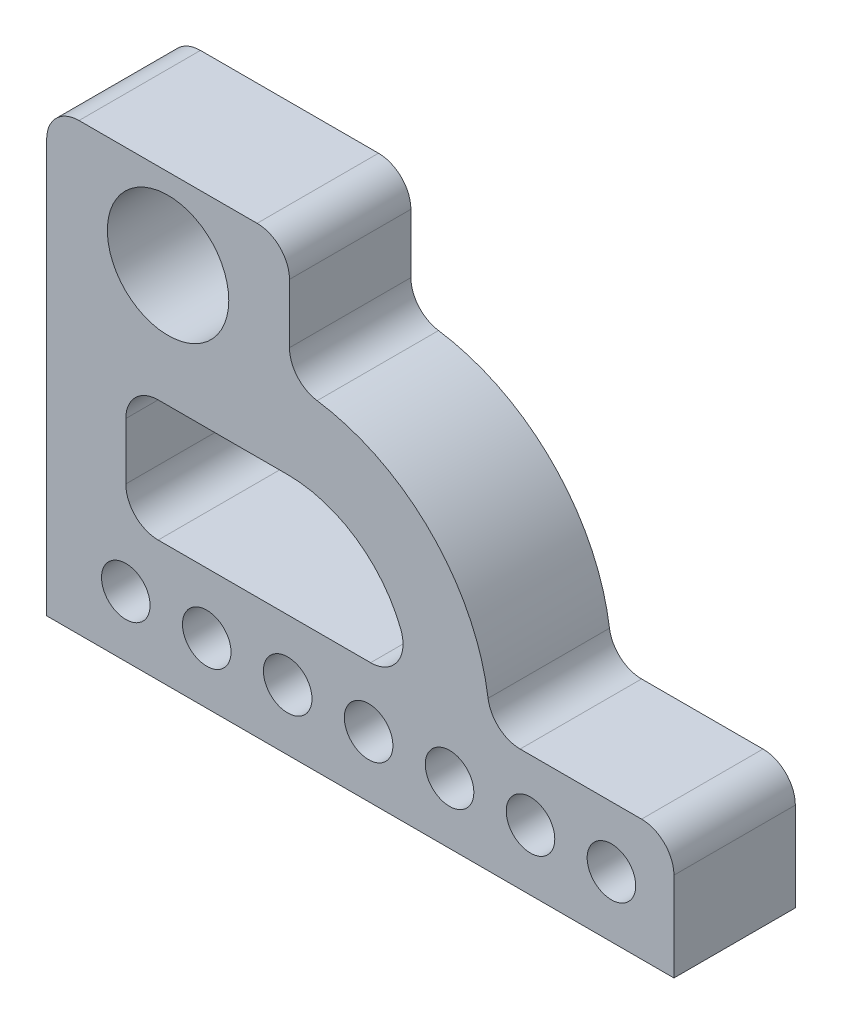
from build123d import *

# Parameters (mm, degrees)
SKETCH1_R           = 15
SKETCH1_R_2         = 6
BOSS_EXTRUDE1_DEPTH = 30


with BuildPart() as part:
    # Sketch1 → Boss-Extrude1 (new body)
    with BuildSketch(Plane.XY):
        with BuildLine():
            Line((-59.555920585, -15.55654054), (95.444079415, -15.55654054))
            Line((95.444079415, -15.55654054), (95.444079415, 6.44345946))
            ThreePointArc((95.444079415, 6.44345946), (93.100933664, 12.100313709), (87.444079415, 14.44345946))
            Line((87.444079415, 14.44345946), (57.445626465, 14.44345946))
            ThreePointArc((57.445626465, 14.44345946), (52.193369151, 16.409075224), (49.522091781, 21.340011184))
            ThreePointArc((49.522091781, 21.340011184), (35.491805322, 49.661803472), (7.279378806, 63.910727872))
            ThreePointArc((7.279378806, 63.910727872), (2.389428109, 66.596609718), (0.444079415, 71.825490818))
            Line((0.444079415, 71.825490818), (0.444079415, 86.44345946))
            ThreePointArc((0.444079415, 86.44345946), (-1.899066336, 92.100313709), (-7.555920585, 94.44345946))
            Line((-7.555920585, 94.44345946), (-51.555920585, 94.44345946))
            ThreePointArc((-51.555920585, 94.44345946), (-57.212774835, 92.100313709), (-59.555920585, 86.44345946))
            Line((-59.555920585, 86.44345946), (-59.555920585, -15.55654054))
        make_face()
        with Locations((-29.555920585, 74.44345946)):
            Circle(SKETCH1_R, mode=Mode.SUBTRACT)
        with Locations((-40, -0.55654054)):
            Circle(SKETCH1_R_2, mode=Mode.SUBTRACT)
        with Locations((-20, -0.55654054)):
            Circle(SKETCH1_R_2, mode=Mode.SUBTRACT)
        with Locations((0, -0.55654054)):
            Circle(SKETCH1_R_2, mode=Mode.SUBTRACT)
        with Locations((20, -0.55654054)):
            Circle(SKETCH1_R_2, mode=Mode.SUBTRACT)
        with Locations((40, -0.55654054)):
            Circle(SKETCH1_R_2, mode=Mode.SUBTRACT)
        with Locations((60, -0.55654054)):
            Circle(SKETCH1_R_2, mode=Mode.SUBTRACT)
        with Locations((80, -0.55654054)):
            Circle(SKETCH1_R_2, mode=Mode.SUBTRACT)
        with BuildLine():
            Line((0, 44.44345946), (-32, 44.44345946))
            ThreePointArc((-32, 44.44345946), (-37.656854249, 42.100313709), (-40, 36.44345946))
            Line((-40, 36.44345946), (-40, 22.44345946))
            ThreePointArc((-40, 22.44345946), (-37.656854249, 16.78660521), (-32, 14.44345946))
            Line((-32, 14.44345946), (20.493901532, 14.44345946))
            ThreePointArc((20.493901532, 14.44345946), (27.099684123, 17.930850861), (27.946229362, 25.352550369))
            ThreePointArc((27.946229362, 25.352550369), (16.922282245, 39.215144175), (0, 44.44345946))
        make_face(mode=Mode.SUBTRACT)
    extrude(amount=BOSS_EXTRUDE1_DEPTH)


solid = part.part
